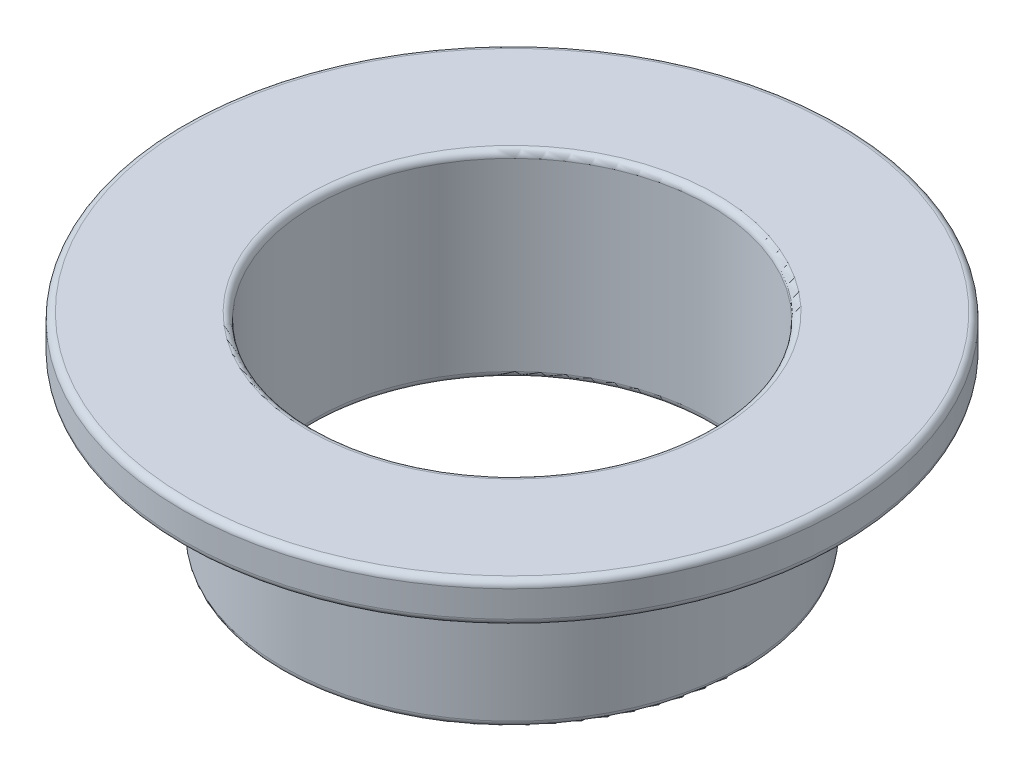
from build123d import *

# Parameters (mm, degrees)
SKETCH1_R           = 7
SKETCH1_R_2         = 6
BOSS_EXTRUDE1_DEPTH = 6
BOSS_EXTRUDE2_START = -1.2
SKETCH2_R           = 10
SKETCH2_R_2         = 6
BOSS_EXTRUDE2_DEPTH = 1.2
FILLET1_R           = 0.2


with BuildPart() as part:
    # Sketch1 → Boss-Extrude1 (new body)
    with BuildSketch(Plane(origin=(0, 0, 0), x_dir=(1, 0, 0), z_dir=(0, 1, 0))):
        with Locations(Location((0, 0, 0), (0, 0, 270))):
            Circle(SKETCH1_R)
        with Locations(Location((0, 0, 0), (0, 0, 270))):
            Circle(SKETCH1_R_2, mode=Mode.SUBTRACT)
    extrude(amount=BOSS_EXTRUDE1_DEPTH)

    # Sketch2 → Boss-Extrude2 (add)
    with BuildSketch(Plane(origin=(0, 6, 0), x_dir=(1, 0, 0), z_dir=(0, 1, 0)).offset(BOSS_EXTRUDE2_START)):
        with Locations(Location((0, 0, 0), (0, 0, 270))):
            Circle(SKETCH2_R)
        with Locations(Location((0, 0, 0), (0, 0, 270))):
            Circle(SKETCH2_R_2, mode=Mode.SUBTRACT)
    extrude(amount=BOSS_EXTRUDE2_DEPTH)

    # Fillet1
    fillet1_edges = [part.edges().sort_by_distance(p)[0] for p in [
        (0, 6, -10),
        (0, 4.8, -10),
        (0, 0, -7),
        (0, 0, -6),
        (0, 6, -6),
    ]]
    fillet(fillet1_edges, radius=FILLET1_R)


solid = part.part
